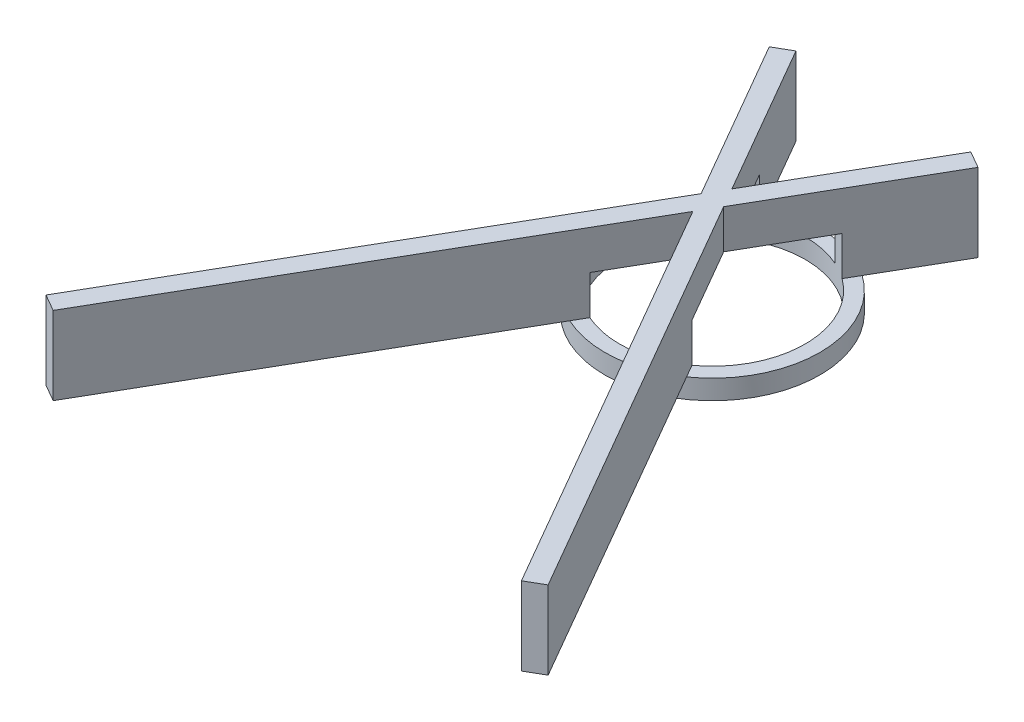
from build123d import *

# Parameters (mm, degrees)
SKETCH1_R           = 11
SKETCH1_R_2         = 9.5
BOSS_EXTRUDE1_DEPTH = 2
EXTRUDE_THIN1_DEPTH = 8
CUT_EXTRUDE1_START  = -6
SKETCH3_R           = 9.5
CUT_EXTRUDE1_DEPTH  = 6


with BuildPart() as part:
    # Sketch1 → Boss-Extrude1 (new body)
    with BuildSketch(Plane(origin=(0, 2, 0), x_dir=(1, 0, 0), z_dir=(0, 1, 0))):
        with Locations(Location((0, 0, 0), (0, 0, 270))):
            Circle(SKETCH1_R)
        with Locations(Location((0, 0, 0), (0, 0, 270))):
            Circle(SKETCH1_R_2, mode=Mode.SUBTRACT)
    extrude(amount=-BOSS_EXTRUDE1_DEPTH)

    # Sketch2 → Extrude-Thin1 (add)
    with BuildSketch(Plane(origin=(0, 2, 0), x_dir=(1, 0, 0), z_dir=(0, 1, 0))):
        Polygon((-23.960036171, -43.5), (10.68097998, 16.5), (8.948929172, 17.5), (-25.692086979, -42.5), align=None)
        Polygon((-10.68097998, 16.5), (23.960036171, -43.5), (25.692086979, -42.5), (-8.948929172, 17.5), align=None)
    extrude(amount=EXTRUDE_THIN1_DEPTH)

    # Sketch3 → Cut-Extrude1 (cut)
    with BuildSketch(Plane.XZ.offset(CUT_EXTRUDE1_START)):
        with Locations(Location((0, 0, 0), (0, 0, 90))):
            Circle(SKETCH3_R)
    extrude(amount=CUT_EXTRUDE1_DEPTH, mode=Mode.SUBTRACT)


solid = part.part
